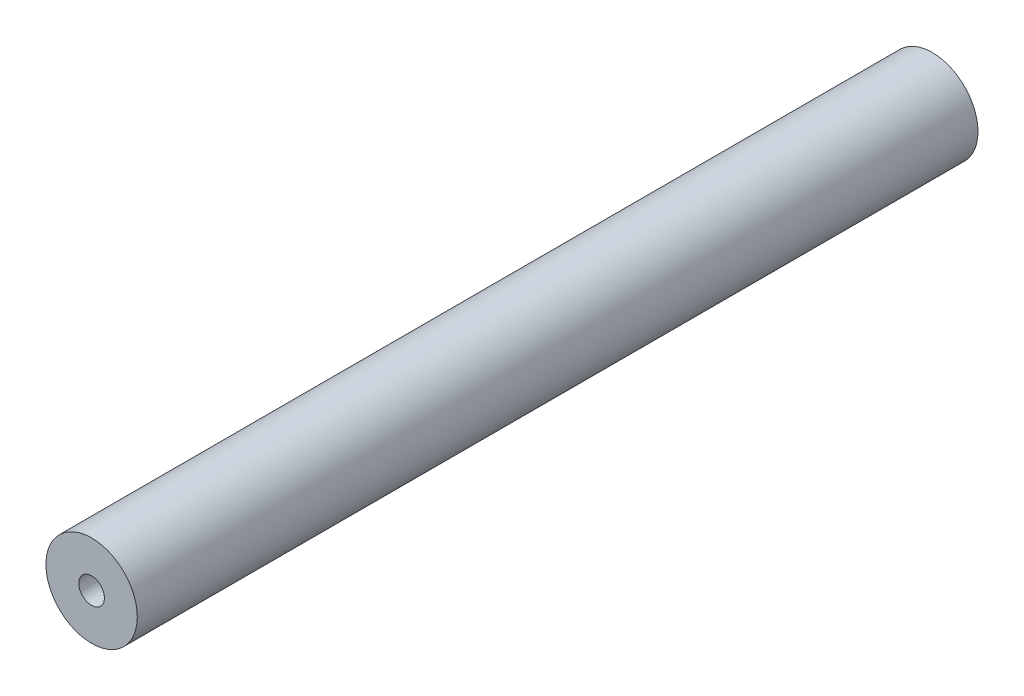
from build123d import *

# Parameters (mm, degrees)
SKETCH1_R           = 31.75
BOSS_EXTRUDE1_DEPTH = 584.2
SKETCH2_R           = 8.89
CUT_EXTRUDE1_DEPTH  = 586.923002621


with BuildPart() as part:
    # Sketch1 → Boss-Extrude1 (new body)
    with BuildSketch(Plane.XY):
        Circle(SKETCH1_R)
    extrude(amount=BOSS_EXTRUDE1_DEPTH)

    # Sketch2 → Cut-Extrude1 (cut, through all)
    with BuildSketch(Plane(origin=(0, 0, 0), x_dir=(-1, 0, 0), z_dir=(0, 0, -1))):
        Circle(SKETCH2_R)
    extrude(amount=-CUT_EXTRUDE1_DEPTH, mode=Mode.SUBTRACT)


solid = part.part
